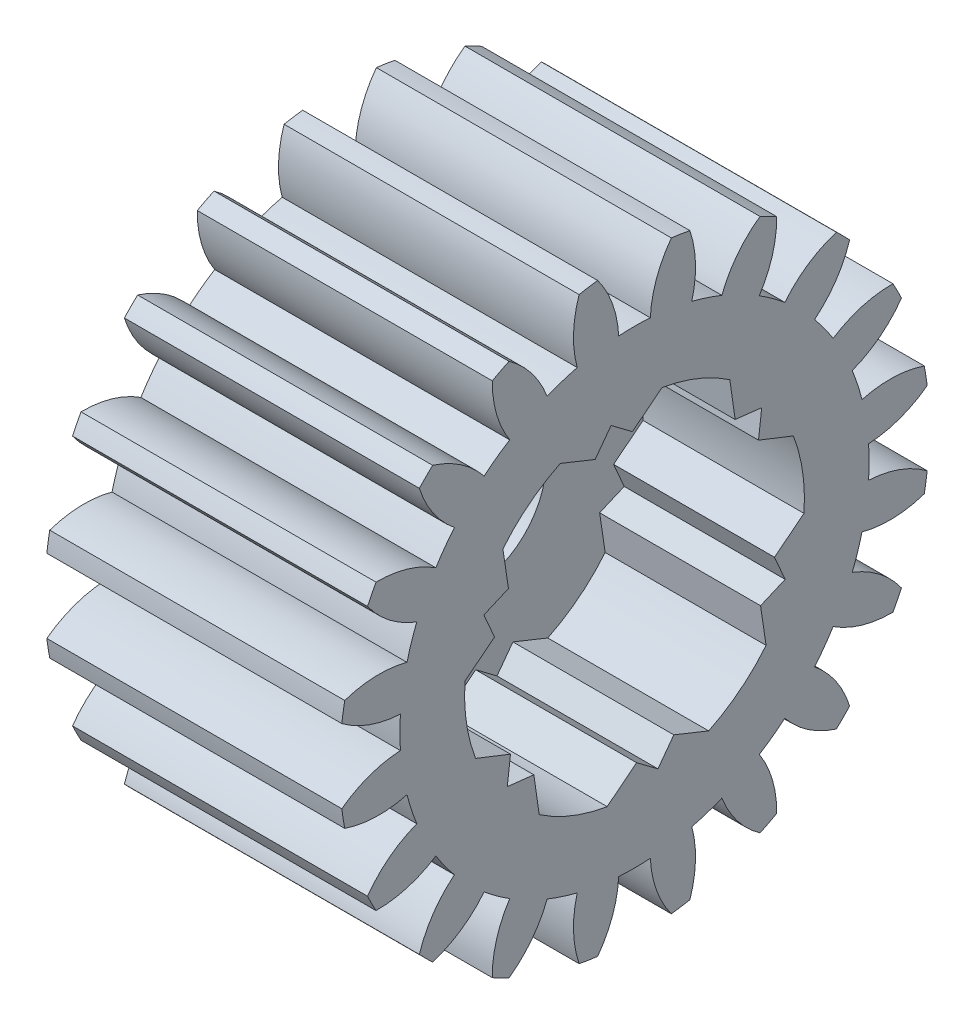
from build123d import *

# Parameters (mm, degrees)
BASPROSKE_W             = 5.5
BASPROSKE_H             = 5.5
TOOTHCUT_DEPTH          = 10.526279442
TEETHCUTS_COUNT         = 20
TEETHCUTS_ANGLE         = 342
BORSKE_R                = 0.5
BORE_DEPTH              = 50.0008636
CUT_EXTRUDE1_DEPTH      = 10.476593643
CUT_EXTRUDE1_DEPTH_BACK = 10.476593643
SKETCH3_R               = 3.65
SKETCH3_R_2             = 1.35
BOSS_EXTRUDE1_DEPTH     = 2.5


with BuildPart() as part:
    # BasProSke → Base-Revolve (revolve)
    with BuildSketch(Plane(origin=(0, 0, 0), x_dir=(1, 0, 0), z_dir=(0, 1, 0)), mode=Mode.PRIVATE) as base_revolve_sk:
        with Locations((2.75, 2.75)):
            Rectangle(BASPROSKE_W, BASPROSKE_H)
    revolve(base_revolve_sk.sketch.rotate(Axis((-10, 0, 0), (1, 0, 0)), 180), axis=Axis((-10, 0, 0), (1, 0, 0)))

    # TooCutSke → ToothCut (cut, through all)
    with BuildSketch(Plane(origin=(0, 0, 0), x_dir=(0, 0, -1), z_dir=(1, 0, 0))):
        with BuildLine():
            ThreePointArc((0.29465164, 4.364064208), (0, 4.374), (-0.29465164, 4.364064208))
            ThreePointArc((-0.29465164, 4.364064208), (-0.414807829, 4.95335164), (-0.704719584, 5.480275127))
            ThreePointArc((-0.704719584, 5.480275127), (0, 5.5254), (0.704719584, 5.480275127))
            ThreePointArc((0.704719584, 5.480275127), (0.414807829, 4.95335164), (0.29465164, 4.364064208))
        make_face()
    toothcut = extrude(amount=TOOTHCUT_DEPTH, mode=Mode.SUBTRACT)

    # TeethCuts: ToothCut ×20 about axis
    teethcuts_axis = Axis((-10, 0, 0), (1, 0, 0))
    for i in range(1, TEETHCUTS_COUNT):
        add(toothcut.rotate(teethcuts_axis, i * TEETHCUTS_ANGLE / (TEETHCUTS_COUNT - 1)), mode=Mode.SUBTRACT)

    # BorSke → Bore (cut, symmetric)
    with BuildSketch(Plane(origin=(0, 0, 0), x_dir=(0, 0, -1), z_dir=(1, 0, 0))):
        with Locations(Location((0, 0, 0), (0, 0, 180))):
            Circle(BORSKE_R)
    extrude(amount=BORE_DEPTH, both=True, mode=Mode.SUBTRACT)

    # Sketch2 → Cut-Extrude1 (cut, two sides: drawn at the far end of the back side and taken through both)
    with BuildSketch(Plane.ZY.offset(-CUT_EXTRUDE1_DEPTH_BACK)):
        with BuildLine():
            Line((-1.777198988, 2.623027169), (-1.87625046, 1.9300706))
            Line((-1.87625046, 1.9300706), (-2.371433872, 1.873523785))
            Line((-2.371433872, 1.873523785), (-2.311857805, 1.378695687))
            Line((-2.311857805, 1.378695687), (-2.963084724, 1.121978916))
            ThreePointArc((-2.963084724, 1.121978916), (-3.135124987, 0.457929127), (-3.160207657, -0.227585887))
            Line((-3.160207657, -0.227585887), (-2.6096154, -0.659845262))
            Line((-2.6096154, -0.659845262), (-2.808236128, -1.116960084))
            Line((-2.808236128, -1.116960084), (-2.349914391, -1.312779746))
            Line((-2.349914391, -1.312779746), (-2.453204606, -2.005117186))
            ThreePointArc((-2.453204606, -2.005117186), (-1.964140751, -2.48613332), (-1.383008669, -2.850613056))
            Line((-1.383008669, -2.850613056), (-0.733364941, -2.589915862))
            Line((-0.733364941, -2.589915862), (-0.436802256, -2.990483869))
            Line((-0.436802256, -2.990483869), (-0.038056586, -2.691475433))
            Line((-0.038056586, -2.691475433), (0.509880118, -3.127096103))
            ThreePointArc((0.509880118, -3.127096103), (1.170984237, -2.944062446), (1.777198988, -2.623027169))
            Line((1.777198988, -2.623027169), (1.87625046, -1.9300706))
            Line((1.87625046, -1.9300706), (2.371433872, -1.873523785))
            Line((2.371433872, -1.873523785), (2.311857805, -1.378695687))
            Line((2.311857805, -1.378695687), (2.963084724, -1.121978916))
            ThreePointArc((2.963084724, -1.121978916), (3.135124987, -0.457929127), (3.160207657, 0.227585887))
            Line((3.160207657, 0.227585887), (2.6096154, 0.659845262))
            Line((2.6096154, 0.659845262), (2.808236128, 1.116960084))
            Line((2.808236128, 1.116960084), (2.349914391, 1.312779746))
            Line((2.349914391, 1.312779746), (2.453204606, 2.005117186))
            ThreePointArc((2.453204606, 2.005117186), (1.964140751, 2.48613332), (1.383008669, 2.850613056))
            Line((1.383008669, 2.850613056), (0.733364941, 2.589915862))
            Line((0.733364941, 2.589915862), (0.436802256, 2.990483869))
            Line((0.436802256, 2.990483869), (0.038056586, 2.691475433))
            Line((0.038056586, 2.691475433), (-0.509880118, 3.127096103))
            ThreePointArc((-0.509880118, 3.127096103), (-1.170984237, 2.944062446), (-1.777198988, 2.623027169))
        make_face()
    extrude(amount=CUT_EXTRUDE1_DEPTH + CUT_EXTRUDE1_DEPTH_BACK, mode=Mode.SUBTRACT)

    # Sketch3 → Boss-Extrude1 (add)
    with BuildSketch(Plane.ZY):
        Circle(SKETCH3_R)
        Circle(SKETCH3_R_2, mode=Mode.SUBTRACT)
    extrude(amount=-BOSS_EXTRUDE1_DEPTH)


solid = part.part
